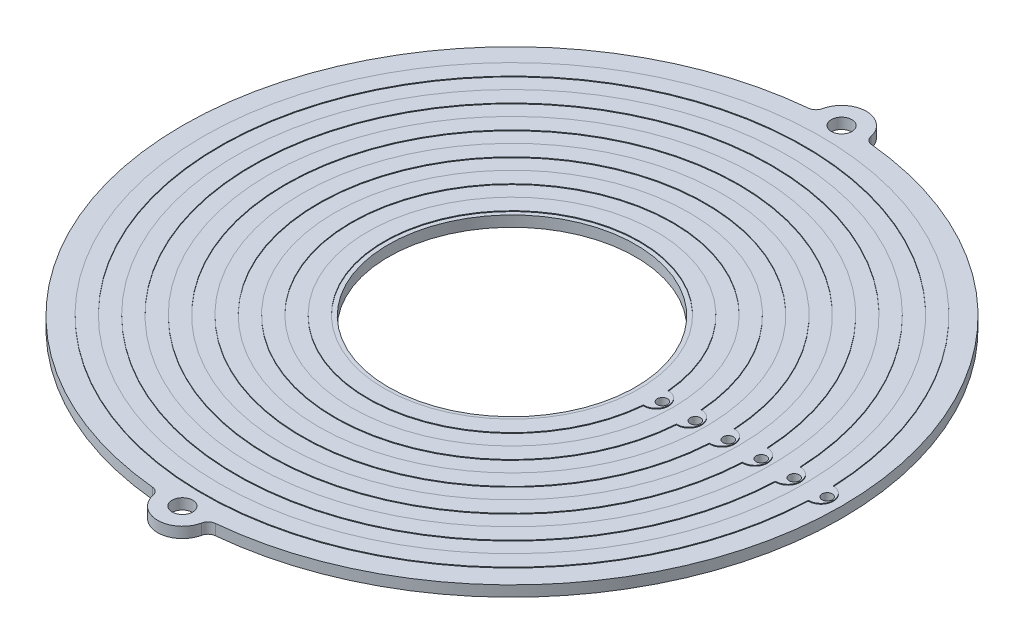
from build123d import *

# Parameters (mm, degrees)
SKETCH1_R            = 15
SKETCH1_R_2          = 1.25
BOSS_EXTRUDE1_DEPTH  = 1.3
FILLET1_R            = 1
SKETCH2_R            = 35.5
SKETCH2_R_2          = 0.625
BOSS_EXTRUDE2_DEPTH  = 0.1
SKETCH4_R            = 0.625
SKETCH4_R_2          = 31.5
BOSS_EXTRUDE4_DEPTH  = 0.1
SKETCH5_R            = 27.5
SKETCH5_R_2          = 0.625
BOSS_EXTRUDE5_DEPTH  = 0.1
SKETCH6_R            = 23.5
SKETCH6_R_2          = 0.625
BOSS_EXTRUDE6_DEPTH  = 0.1
SKETCH7_R            = 19.5
SKETCH7_R_2          = 0.625
BOSS_EXTRUDE7_DEPTH  = 0.1
SKETCH8_R            = 15.5
SKETCH8_R_2          = 0.625
BOSS_EXTRUDE8_DEPTH  = 0.1
BOSS_EXTRUDE9_DEPTH  = 0.1
BOSS_EXTRUDE10_DEPTH = 0.1
BOSS_EXTRUDE11_DEPTH = 0.1
BOSS_EXTRUDE12_DEPTH = 0.1
BOSS_EXTRUDE13_DEPTH = 0.1
BOSS_EXTRUDE14_DEPTH = 0.1
CUT_EXTRUDE1_START   = -1.5
SKETCH10_R           = 0.625
CUT_EXTRUDE1_DEPTH   = 1.5


with BuildPart() as part:
    # Sketch1 → Boss-Extrude1 (new body)
    with BuildSketch(Plane(origin=(0, 0, 0), x_dir=(1, 0, 0), z_dir=(0, 1, 0))):
        with BuildLine():
            ThreePointArc((-40, 0), (-29.325037044, -27.203716701), (-2.997889883, -39.8875))
            ThreePointArc((-2.997889883, -39.8875), (0, -43), (2.997889883, -39.8875))
            ThreePointArc((2.997889883, -39.8875), (40, 0), (2.997889883, 39.8875))
            ThreePointArc((2.997889883, 39.8875), (0, 43), (-2.997889883, 39.8875))
            ThreePointArc((-2.997889883, 39.8875), (-29.325037044, 27.203716701), (-40, 0))
        make_face()
        with Locations(Location((0, 0, 0), (0, 0, 270))):
            Circle(SKETCH1_R, mode=Mode.SUBTRACT)
        with Locations(Location((0, 40, 0), (0, 0, 270))):
            Circle(SKETCH1_R_2, mode=Mode.SUBTRACT)
        with Locations(Location((0, -40, 0), (0, 0, 270))):
            Circle(SKETCH1_R_2, mode=Mode.SUBTRACT)
    extrude(amount=BOSS_EXTRUDE1_DEPTH)

    # Fillet1
    fillet1_edges = [part.edges().sort_by_distance(p)[0] for p in [
        (-2.997889883, 0.65, -39.8875),
        (2.997889883, 0.65, -39.8875),
        (2.997889883, 0.65, 39.8875),
        (-2.997889883, 0.65, 39.8875),
    ]]
    fillet(fillet1_edges, radius=FILLET1_R)

    # Sketch2 → Boss-Extrude2 (add)
    with BuildSketch(Plane(origin=(0, 1.3, 0), x_dir=(1, 0, 0), z_dir=(0, 1, 0))):
        with BuildLine():
            ThreePointArc((37.47, 1.49969997), (-37.5, 0), (37.47, -1.49969997))
            ThreePointArc((37.47, -1.49969997), (39, 0), (37.47, 1.49969997))
        make_face()
        with Locations(Location((0, 0, 0), (0, 0, 270))):
            Circle(SKETCH2_R, mode=Mode.SUBTRACT)
        with Locations(Location((38.25, 0, 0), (0, 0, 270))):
            Circle(SKETCH2_R_2, mode=Mode.SUBTRACT)
    extrude(amount=BOSS_EXTRUDE2_DEPTH)

    # Sketch4 → Boss-Extrude4 (add)
    with BuildSketch(Plane(origin=(0, 1.3, 0), x_dir=(1, 0, 0), z_dir=(0, 1, 0))):
        with BuildLine():
            ThreePointArc((33.46641791, -1.499624034), (35, 0), (33.46641791, 1.499624034))
            ThreePointArc((33.46641791, 1.499624034), (-33.5, 0), (33.46641791, -1.499624034))
        make_face()
        with Locations(Location((34.25, 0, 0), (0, 0, 270))):
            Circle(SKETCH4_R, mode=Mode.SUBTRACT)
        with Locations(Location((0, 0, 0), (0, 0, 270))):
            Circle(SKETCH4_R_2, mode=Mode.SUBTRACT)
    extrude(amount=BOSS_EXTRUDE4_DEPTH)

    # Sketch5 → Boss-Extrude5 (add)
    with BuildSketch(Plane(origin=(0, 1.3, 0), x_dir=(1, 0, 0), z_dir=(0, 1, 0))):
        with BuildLine():
            ThreePointArc((29.461864407, 1.499515147), (-29.5, 0), (29.461864407, -1.499515147))
            ThreePointArc((29.461864407, -1.499515147), (31, 0), (29.461864407, 1.499515147))
        make_face()
        with Locations(Location((0, 0, 0), (0, 0, 270))):
            Circle(SKETCH5_R, mode=Mode.SUBTRACT)
        with Locations(Location((30.25, 0, 0), (0, 0, 270))):
            Circle(SKETCH5_R_2, mode=Mode.SUBTRACT)
    extrude(amount=BOSS_EXTRUDE5_DEPTH)

    # Sketch6 → Boss-Extrude6 (add)
    with BuildSketch(Plane(origin=(0, 1.3, 0), x_dir=(1, 0, 0), z_dir=(0, 1, 0))):
        with BuildLine():
            ThreePointArc((25.455882353, 1.499351071), (-25.5, 0), (25.455882353, -1.499351071))
            ThreePointArc((25.455882353, -1.499351071), (27, 0), (25.455882353, 1.499351071))
        make_face()
        with Locations(Location((0, 0, 0), (0, 0, 270))):
            Circle(SKETCH6_R, mode=Mode.SUBTRACT)
        with Locations(Location((26.25, 0, 0), (0, 0, 270))):
            Circle(SKETCH6_R_2, mode=Mode.SUBTRACT)
    extrude(amount=BOSS_EXTRUDE6_DEPTH)

    # Sketch7 → Boss-Extrude7 (add)
    with BuildSketch(Plane(origin=(0, 1.3, 0), x_dir=(1, 0, 0), z_dir=(0, 1, 0))):
        with BuildLine():
            ThreePointArc((21.447674419, 1.499087067), (-21.5, 0), (21.447674419, -1.499087067))
            ThreePointArc((21.447674419, -1.499087067), (23, 0), (21.447674419, 1.499087067))
        make_face()
        with Locations(Location((0, 0, 0), (0, 0, 270))):
            Circle(SKETCH7_R, mode=Mode.SUBTRACT)
        with Locations(Location((22.25, 0, 0), (0, 0, 270))):
            Circle(SKETCH7_R_2, mode=Mode.SUBTRACT)
    extrude(amount=BOSS_EXTRUDE7_DEPTH)

    # Sketch8 → Boss-Extrude8 (add)
    with BuildSketch(Plane(origin=(0, 1.3, 0), x_dir=(1, 0, 0), z_dir=(0, 1, 0))):
        with BuildLine():
            ThreePointArc((17.435714286, 1.498621816), (-17.5, 0), (17.435714286, -1.498621816))
            ThreePointArc((17.435714286, -1.498621816), (19, 0), (17.435714286, 1.498621816))
        make_face()
        with Locations(Location((0, 0, 0), (0, 0, 270))):
            Circle(SKETCH8_R, mode=Mode.SUBTRACT)
        with Locations(Location((18.25, 0, 0), (0, 0, 270))):
            Circle(SKETCH8_R_2, mode=Mode.SUBTRACT)
    extrude(amount=BOSS_EXTRUDE8_DEPTH)

    # Sketch12 → Boss-Extrude9 (add)
    with BuildSketch(Plane.XZ):
        with BuildLine():
            Line((3.725557051, 38.821646341), (3.510621067, 36.581935976))
            ThreePointArc((3.510621067, 36.581935976), (36.75, 0), (3.510621067, -36.581935976))
            Line((3.510621067, -36.581935976), (3.725557051, -38.821646341))
            ThreePointArc((3.725557051, -38.821646341), (39, 0), (3.725557051, 38.821646341))
        make_face()
    extrude(amount=BOSS_EXTRUDE9_DEPTH)

    # Sketch13 → Boss-Extrude10 (add)
    with BuildSketch(Plane.XZ):
        with BuildLine():
            Line((3.367330411, 35.088795732), (3.128512652, 32.600228659))
            ThreePointArc((3.128512652, 32.600228659), (32.75, 0), (3.128512652, -32.600228659))
            Line((3.128512652, -32.600228659), (3.367330411, -35.088795732))
            ThreePointArc((3.367330411, -35.088795732), (35.25, 0), (3.367330411, 35.088795732))
        make_face()
    extrude(amount=BOSS_EXTRUDE10_DEPTH)

    # Sketch14 → Boss-Extrude11 (add)
    with BuildSketch(Plane.XZ):
        with BuildLine():
            Line((2.985221996, 31.107088415), (2.746404236, 28.618521341))
            ThreePointArc((2.746404236, 28.618521341), (28.75, 0), (2.746404236, -28.618521341))
            Line((2.746404236, -28.618521341), (2.985221996, -31.107088415))
            ThreePointArc((2.985221996, -31.107088415), (31.25, 0), (2.985221996, 31.107088415))
        make_face()
    extrude(amount=BOSS_EXTRUDE11_DEPTH)

    # Sketch15 → Boss-Extrude12 (add)
    with BuildSketch(Plane.XZ):
        with BuildLine():
            Line((2.60311358, 27.125381098), (2.364295821, 24.636814024))
            ThreePointArc((2.364295821, 24.636814024), (24.75, 0), (2.364295821, -24.636814024))
            Line((2.364295821, -24.636814024), (2.60311358, -27.125381098))
            ThreePointArc((2.60311358, -27.125381098), (27.25, 0), (2.60311358, 27.125381098))
        make_face()
    extrude(amount=BOSS_EXTRUDE12_DEPTH)

    # Sketch16 → Boss-Extrude13 (add)
    with BuildSketch(Plane.XZ):
        with BuildLine():
            Line((1.982187405, 20.655106707), (2.221005165, 23.14367378))
            ThreePointArc((2.221005165, 23.14367378), (23.25, 0), (2.221005165, -23.14367378))
            Line((2.221005165, -23.14367378), (1.982187405, -20.655106707))
            ThreePointArc((1.982187405, -20.655106707), (20.75, 0), (1.982187405, 20.655106707))
        make_face()
    extrude(amount=BOSS_EXTRUDE13_DEPTH)

    # Sketch17 → Boss-Extrude14 (add)
    with BuildSketch(Plane.XZ):
        with BuildLine():
            Line((1.838896749, 19.161966463), (1.60007899, 16.67339939))
            ThreePointArc((1.60007899, 16.67339939), (16.75, 0), (1.60007899, -16.67339939))
            Line((1.60007899, -16.67339939), (1.838896749, -19.161966463))
            ThreePointArc((1.838896749, -19.161966463), (19.25, 0), (1.838896749, 19.161966463))
        make_face()
    extrude(amount=BOSS_EXTRUDE14_DEPTH)

    # Sketch10 → Cut-Extrude1 (cut)
    with BuildSketch(Plane(origin=(0, 1.3, 0), x_dir=(1, 0, 0), z_dir=(0, 1, 0)).offset(CUT_EXTRUDE1_START)):
        with Locations(Location((38.25, 0, 0), (0, 0, 90))):
            Circle(SKETCH10_R)
        with Locations(Location((34.25, 0, 0), (0, 0, 90))):
            Circle(SKETCH10_R)
        with Locations(Location((30.25, 0, 0), (0, 0, 90))):
            Circle(SKETCH10_R)
        with Locations(Location((26.25, 0, 0), (0, 0, 90))):
            Circle(SKETCH10_R)
        with Locations(Location((22.25, 0, 0), (0, 0, 90))):
            Circle(SKETCH10_R)
        with Locations(Location((18.25, 0, 0), (0, 0, 90))):
            Circle(SKETCH10_R)
    extrude(amount=CUT_EXTRUDE1_DEPTH, mode=Mode.SUBTRACT)


solid = part.part
